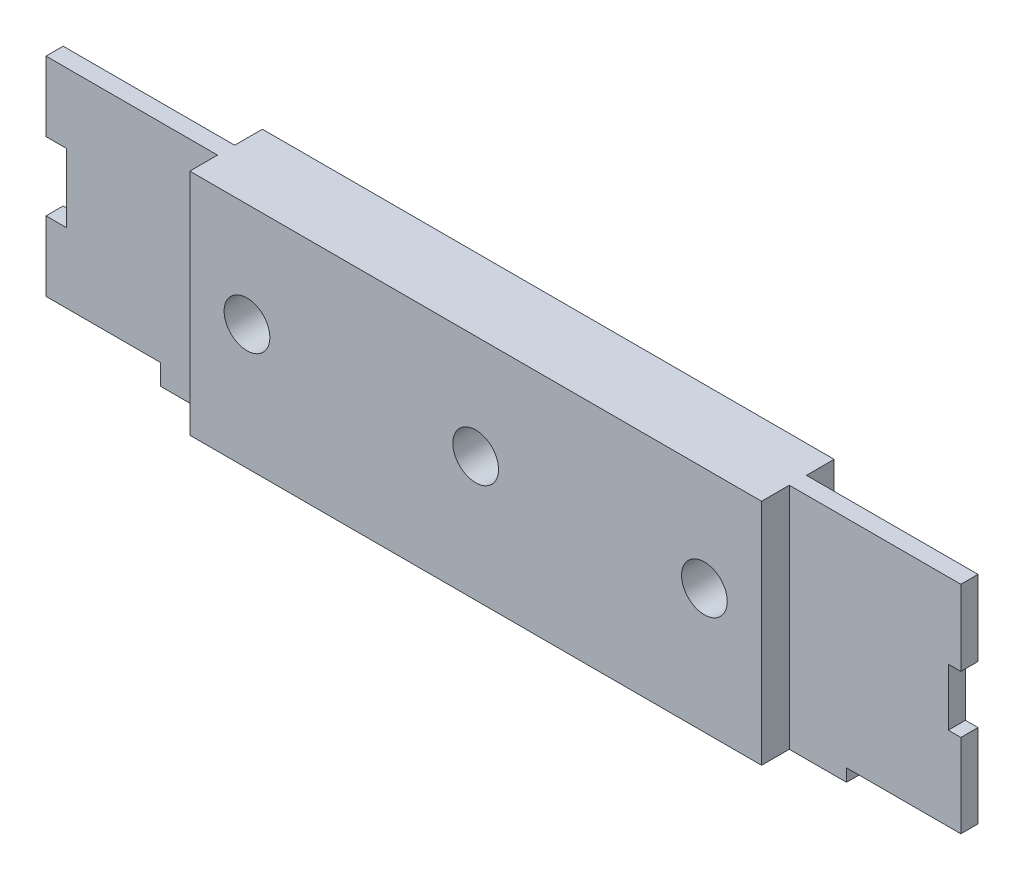
from build123d import *

# Parameters (mm, degrees)
CROQUIS1_R              = 2
SALIENTE_EXTRUIR1_DEPTH = 0.75
CROQUIS2_W              = 50
CROQUIS2_H              = 20
CROQUIS2_R              = 2
SALIENTE_EXTRUIR2_DEPTH = 3.175


with BuildPart() as part:
    # Croquis1 → Saliente-Extruir1 (new, symmetric)
    with BuildSketch(Plane.XY):
        Polygon((-40, 9.1), (40, 9.1), (40, 2.5), (38.9, 2.5), (38.9, -2.5), (40, -2.5), (40, -9.8), (30, -9.8), (30, -10.9), (-30, -10.9), (-30, -9.1), (-40, -9.1), (-40, -3), (-38.2, -3), (-38.2, 3), (-40, 3), align=None)
        with Locations((20, 0)):
            Circle(CROQUIS1_R, mode=Mode.SUBTRACT)
        Circle(CROQUIS1_R, mode=Mode.SUBTRACT)
        with Locations((-20, 0)):
            Circle(CROQUIS1_R, mode=Mode.SUBTRACT)
    extrude(amount=SALIENTE_EXTRUIR1_DEPTH, both=True)

    # Croquis2 → Saliente-Extruir2 (add, symmetric)
    with BuildSketch(Plane.XY):
        with Locations((0, -0.9)):
            Rectangle(CROQUIS2_W, CROQUIS2_H)
        with Locations((-20, 0)):
            Circle(CROQUIS2_R, mode=Mode.SUBTRACT)
        Circle(CROQUIS2_R, mode=Mode.SUBTRACT)
        with Locations((20, 0)):
            Circle(CROQUIS2_R, mode=Mode.SUBTRACT)
    extrude(amount=SALIENTE_EXTRUIR2_DEPTH, both=True)


solid = part.part
